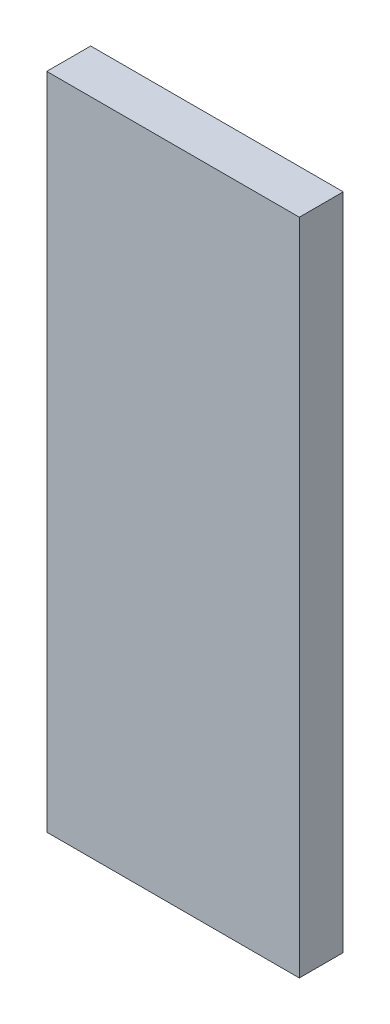
from build123d import *

# Parameters (mm, degrees)
SKETCH1_W           = 15
SKETCH1_H           = 80
BOSS_EXTRUDE1_DEPTH = 5
SKETCH3_W           = 23
SKETCH3_H           = 60
BOSS_EXTRUDE3_DEPTH = 4
SKETCH5_W           = 4
SKETCH5_H           = 50
BOSS_EXTRUDE5_DEPTH = 15
SKETCH6_W           = 15
SKETCH6_H           = 5
CUT_EXTRUDE1_DEPTH  = 80
SKETCH7_W           = 4
SKETCH7_H           = 15
CUT_EXTRUDE2_DEPTH  = 15


with BuildPart() as part:
    # Sketch1 → Boss-Extrude1 (new body)
    with BuildSketch(Plane(origin=(0, 0, 0), x_dir=(1, 0, 0), z_dir=(0, 1, 0))):
        with Locations((7.5, -40)):
            Rectangle(SKETCH1_W, SKETCH1_H)
    extrude(amount=BOSS_EXTRUDE1_DEPTH)

    # Sketch3 → Boss-Extrude3 (add)
    with BuildSketch(Plane(origin=(0, 0, 0), x_dir=(-1, 0, 0), z_dir=(0, 0, -1))):
        with Locations((-7.5, 30)):
            Rectangle(SKETCH3_W, SKETCH3_H)
    extrude(amount=BOSS_EXTRUDE3_DEPTH)

    # Sketch5 → Boss-Extrude5 (add)
    with BuildSketch(Plane(origin=(0, 0, -4), x_dir=(-1, 0, 0), z_dir=(0, 0, -1))):
        with Locations((-0.25, 35)):
            Rectangle(SKETCH5_W, SKETCH5_H)
    extrude(amount=BOSS_EXTRUDE5_DEPTH)

    # Sketch6 → Cut-Extrude1 (cut)
    with BuildSketch(Plane.XY.offset(80)):
        with Locations((7.5, 2.5)):
            Rectangle(SKETCH6_W, SKETCH6_H)
    extrude(amount=-CUT_EXTRUDE1_DEPTH, mode=Mode.SUBTRACT)

    # Sketch7 → Cut-Extrude2 (cut)
    with BuildSketch(Plane(origin=(0, 0, -19), x_dir=(-1, 0, 0), z_dir=(0, 0, -1))):
        with Locations((-0.25, 52.5)):
            Rectangle(SKETCH7_W, SKETCH7_H)
    extrude(amount=-CUT_EXTRUDE2_DEPTH, mode=Mode.SUBTRACT)


solid = part.part
